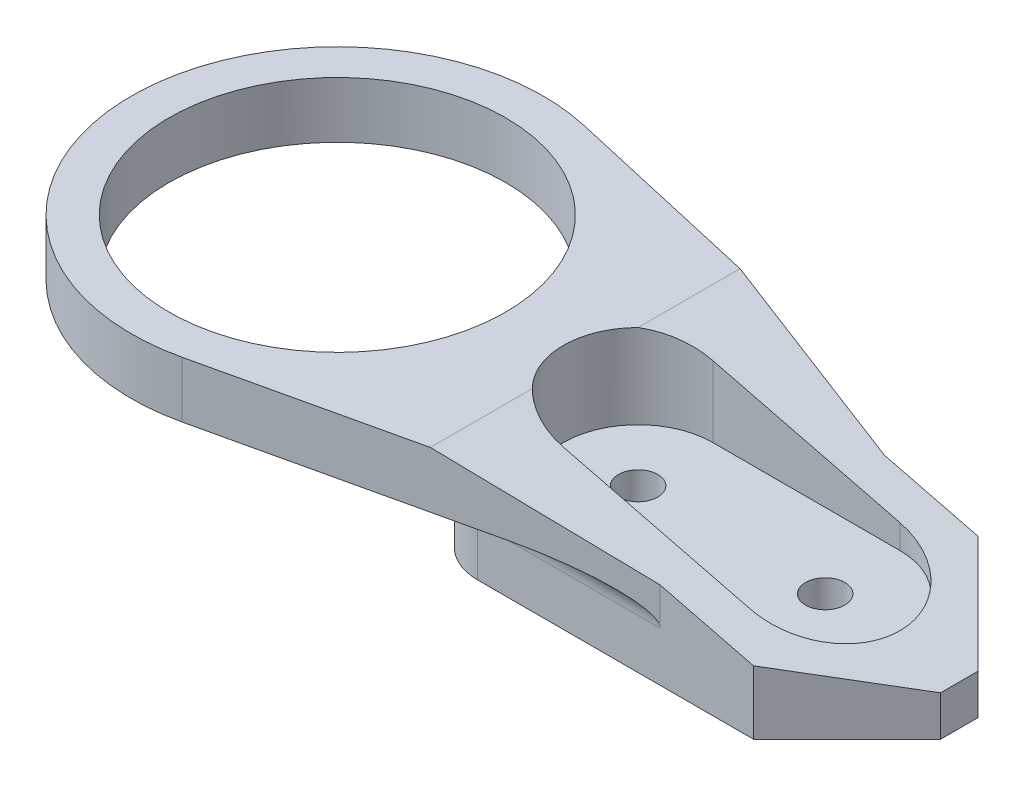
from build123d import *

# Parameters (mm, degrees)
SKETCH1_W           = 25
SKETCH1_H           = 7.15
BOSS_EXTRUDE1_DEPTH = 12
BOSS_EXTRUDE2_DEPTH = 3
CUT_EXTRUDE1_DEPTH  = 21
SKETCH4_R           = 9
CUT_EXTRUDE2_DEPTH  = 10
CHAMFER1_SIZE       = 5
CHAMFER1_SIZE2      = 20
CHAMFER2_SIZE       = 5
SKETCH6_R           = 1.05
CUT_EXTRUDE3_DEPTH  = 10
CUT_EXTRUDE4_DEPTH  = 4.5
FILLET1_R           = 3
FILLET2_R           = 1.5


with BuildPart() as part:
    # Sketch1 → Boss-Extrude1 (new body)
    with BuildSketch(Plane.XY):
        with Locations((12.5, 3.575)):
            Rectangle(SKETCH1_W, SKETCH1_H)
    extrude(amount=BOSS_EXTRUDE1_DEPTH)

    # Sketch2 → Boss-Extrude2 (add)
    with BuildSketch(Plane(origin=(0, 7.15, 0), x_dir=(1, 0, 0), z_dir=(0, 1, 0))):
        with BuildLine():
            Line((15, -12), (15, -6))
            Line((15, -6), (15, 0))
            Line((15, 0), (-5.804949202, 4.737516245))
            ThreePointArc((-5.804949202, 4.737516245), (-19.262380692, -6), (-5.804949202, -16.737516245))
            Line((-5.804949202, -16.737516245), (15, -12))
        make_face()
    extrude(amount=-BOSS_EXTRUDE2_DEPTH)

    # Sketch3 → Cut-Extrude1 (cut)
    with BuildSketch(Plane.XZ.offset(-4.15)):
        Polygon((2.25, 6), (2.25, 12), (0, 12), (0, 0), (2.25, 0), align=None)
    extrude(amount=CUT_EXTRUDE1_DEPTH, mode=Mode.SUBTRACT)

    # Sketch4 → Cut-Extrude2 (cut)
    with BuildSketch(Plane.XZ.offset(-4.15)):
        with Locations(Location((-8.25, 6, 0), (0, 0, 270))):
            Circle(SKETCH4_R)
    extrude(amount=-CUT_EXTRUDE2_DEPTH, mode=Mode.SUBTRACT)

    # Chamfer1
    chamfer1_edges = [part.edges().sort_by_distance(p)[0] for p in [
        (25, 7.15, 6),
    ]]
    chamfer1_side = [part.faces().sort_by_distance(p)[0] for p in [
        (25, 3.575, 6),
    ]]
    chamfer(chamfer1_edges, length=CHAMFER1_SIZE, length2=CHAMFER1_SIZE2, reference=chamfer1_side[0])

    # Chamfer2
    chamfer2_edges = [part.edges().sort_by_distance(p)[0] for p in [
        (25, 1.075, 0),
        (25, 1.075, 12),
    ]]
    chamfer(chamfer2_edges, length=CHAMFER2_SIZE)

    # Sketch6 → Cut-Extrude3 (cut)
    with BuildSketch(Plane(origin=(0, 7.15, 0), x_dir=(1, 0, 0), z_dir=(0, 1, 0))):
        with Locations(Location((7.829893366, -6, 0), (0, 0, 180))):
            Circle(SKETCH6_R)
        with Locations(Location((17.829893366, -6, 0), (0, 0, 180))):
            Circle(SKETCH6_R)
    extrude(amount=-CUT_EXTRUDE3_DEPTH, mode=Mode.SUBTRACT)

    # Sketch7 → Cut-Extrude4 (cut)
    with BuildSketch(Plane(origin=(0, 7.15, 0), x_dir=(1, 0, 0), z_dir=(0, 1, 0))):
        with BuildLine():
            Line((7.829893366, -2), (17.829893366, -2))
            ThreePointArc((17.829893366, -2), (21.829893366, -6), (17.829893366, -10))
            Line((17.829893366, -10), (7.829893366, -10))
            ThreePointArc((7.829893366, -10), (3.829893366, -6), (7.829893366, -2))
        make_face()
    extrude(amount=-CUT_EXTRUDE4_DEPTH, mode=Mode.SUBTRACT)

    # Fillet1
    fillet1_edges = [part.edges().sort_by_distance(p)[0] for p in [
        (2.25, 2.075, 0),
        (2.25, 2.075, 12),
    ]]
    fillet(fillet1_edges, radius=FILLET1_R)

    # Fillet2
    fillet2_edges = [part.edges().sort_by_distance(p)[0] for p in [
        (10.125, 4.15, 0),
        (3.128679656, 4.15, 0.878679656),
        (2.25, 4.15, 6),
        (3.128679656, 4.15, 11.121320344),
        (10.125, 4.15, 12),
    ]]
    fillet(fillet2_edges, radius=FILLET2_R)


solid = part.part
